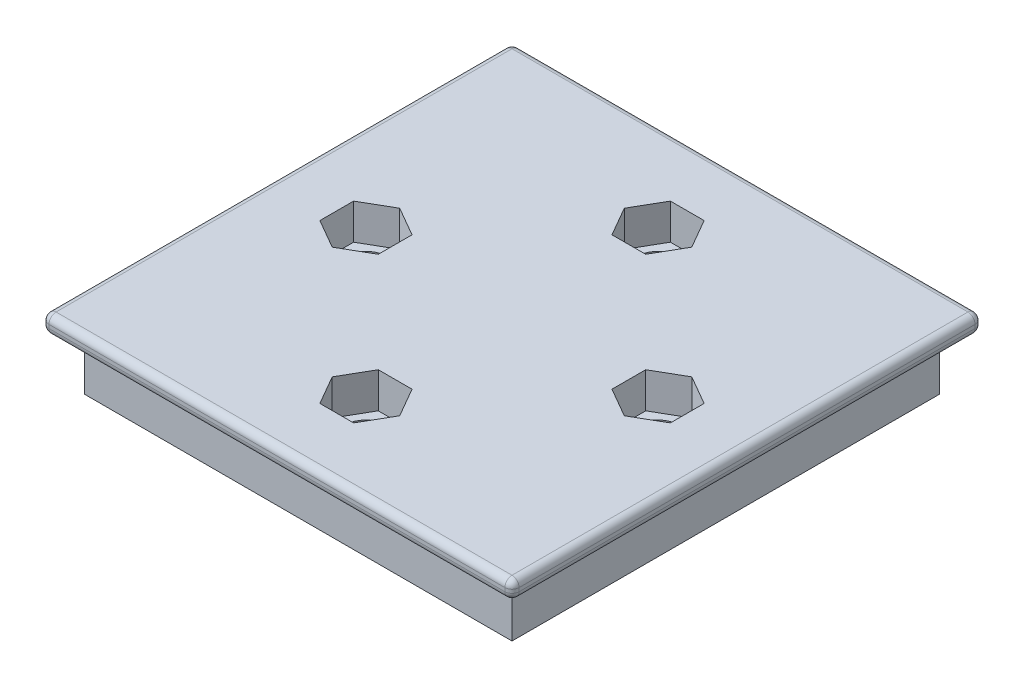
from build123d import *

# Parameters (mm, degrees)
SKETCH1_W           = 60
SKETCH1_H           = 60
SKETCH1_R           = 3
BOSS_EXTRUDE1_DEPTH = 10
SKETCH2_W           = 66
SKETCH2_H           = 66
SKETCH2_W_2         = 60
SKETCH2_H_2         = 60
BOSS_EXTRUDE2_DEPTH = 2.5
CUT_EXTRUDE1_DEPTH  = 5
FILLET1_R           = 1


with BuildPart() as part:
    # Sketch1 → Boss-Extrude1 (new body)
    with BuildSketch(Plane(origin=(0, 0, 0), x_dir=(1, 0, 0), z_dir=(0, 1, 0))):
        Rectangle(SKETCH1_W, SKETCH1_H)
        with Locations(Location((0, 20.5, 0), (0, 0, 270))):
            Circle(SKETCH1_R, mode=Mode.SUBTRACT)
        with Locations(Location((20.5, 0, 0), (0, 0, 270))):
            Circle(SKETCH1_R, mode=Mode.SUBTRACT)
        with Locations(Location((0, -20.5, 0), (0, 0, 270))):
            Circle(SKETCH1_R, mode=Mode.SUBTRACT)
        with Locations(Location((-20.5, 0, 0), (0, 0, 270))):
            Circle(SKETCH1_R, mode=Mode.SUBTRACT)
    extrude(amount=BOSS_EXTRUDE1_DEPTH)

    # Sketch2 → Boss-Extrude2 (add)
    with BuildSketch(Plane(origin=(0, 10, 0), x_dir=(1, 0, 0), z_dir=(0, 1, 0))):
        Rectangle(SKETCH2_W, SKETCH2_H)
        Rectangle(SKETCH2_W_2, SKETCH2_H_2, mode=Mode.SUBTRACT)
    extrude(amount=-BOSS_EXTRUDE2_DEPTH)

    # Sketch3 → Cut-Extrude1 (cut)
    with BuildSketch(Plane(origin=(0, 10, 0), x_dir=(1, 0, 0), z_dir=(0, 1, 0))):
        Polygon((-4.734272207, 20.5), (-2.367136104, 16.4), (2.367136104, 16.4), (4.734272207, 20.5), (2.367136104, 24.6), (-2.367136104, 24.6), align=None)
        Polygon((-20.5, -4.734272207), (-16.4, -2.367136104), (-16.4, 2.367136104), (-20.5, 4.734272207), (-24.6, 2.367136104), (-24.6, -2.367136104), align=None)
        Polygon((20.5, 4.734272207), (16.4, 2.367136104), (16.4, -2.367136104), (20.5, -4.734272207), (24.6, -2.367136104), (24.6, 2.367136104), align=None)
        Polygon((4.734272207, -20.5), (2.367136104, -16.4), (-2.367136104, -16.4), (-4.734272207, -20.5), (-2.367136104, -24.6), (2.367136104, -24.6), align=None)
    extrude(amount=-CUT_EXTRUDE1_DEPTH, mode=Mode.SUBTRACT)

    # Fillet1
    fillet1_edges = [part.edges().sort_by_distance(p)[0] for p in [
        (33, 7.5, 0),
        (33, 8.75, -33),
        (0, 7.5, 33),
        (33, 8.75, 33),
        (-33, 7.5, 0),
        (-33, 8.75, 33),
        (0, 7.5, -33),
        (-33, 8.75, -33),
        (33, 10, 0),
        (0, 10, -33),
        (-33, 10, 0),
        (0, 10, 33),
    ]]
    fillet(fillet1_edges, radius=FILLET1_R)


solid = part.part
